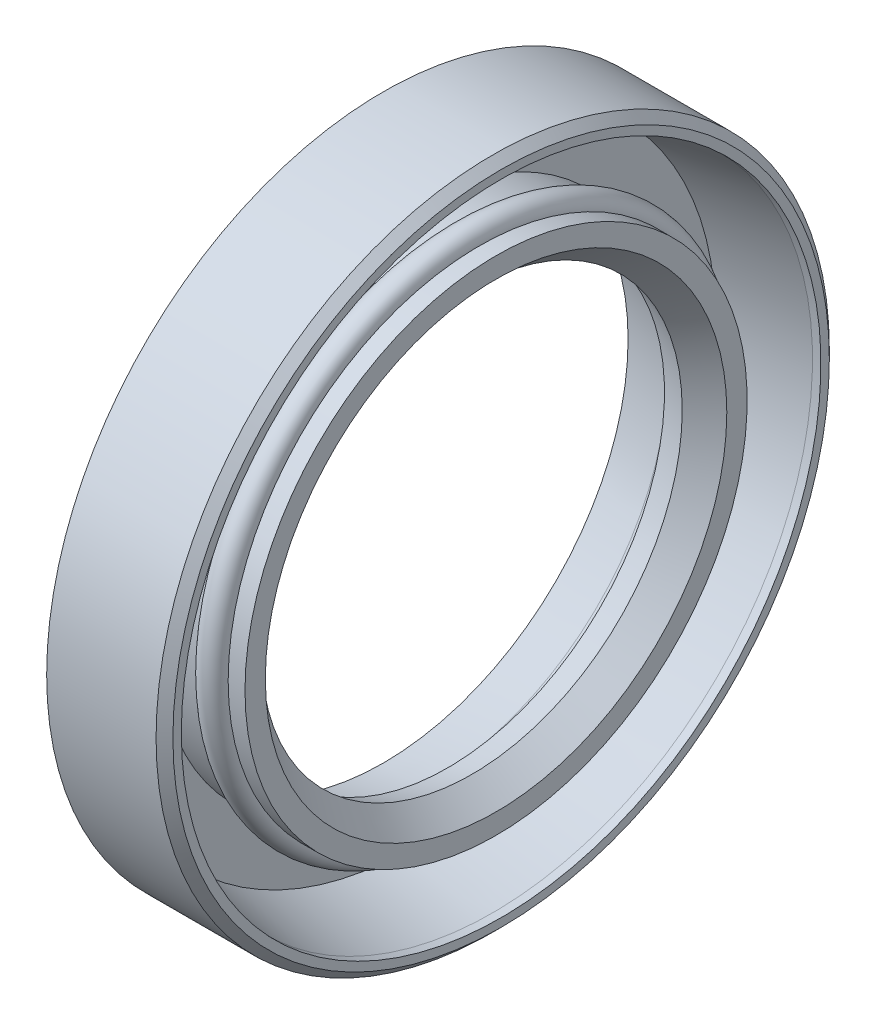
from build123d import *

# Parameters (mm, degrees)
SKETCH1_R = 0.5


with BuildPart() as part:
    # Sketch1 → Revolve1 (revolve)
    with BuildSketch(Plane.XY, mode=Mode.PRIVATE) as revolve1_sk:
        with BuildLine():
            Line((0, 20), (0, 14.544100725))
            Line((0, 14.544100725), (2.85, 14.04156883))
            ThreePointArc((2.85, 14.04156883), (3.545185895, 13.640203066), (3.819736247, 12.885882173))
            Line((3.819736247, 12.885882173), (5.259868124, 12.5))
            Line((5.259868124, 12.5), (6.7, 13.708414126))
            Line((6.7, 13.708414126), (6.7, 14.916828253))
            Line((6.7, 14.916828253), (5.7, 14.916828253))
            ThreePointArc((5.7, 14.916828253), (4.9, 15.716828253), (4.1, 14.916828253))
            Line((4.1, 14.916828253), (1.6, 14.916828253))
            Line((1.6, 14.916828253), (1.6, 18.135997795))
            Line((1.6, 18.135997795), (6.5, 19))
            Line((6.5, 19), (7, 19))
            Line((7, 19), (7, 19.5))
            Line((7, 19.5), (6.5, 20))
            Line((6.5, 20), (0, 20))
        make_face()
        with Locations((4.9, 14.916828253)):
            Circle(SKETCH1_R, mode=Mode.SUBTRACT)
    revolve(revolve1_sk.sketch.rotate(Axis((0, 0, 0), (1, 0, 0)), 90), axis=Axis((0, 0, 0), (1, 0, 0)))


solid = part.part
